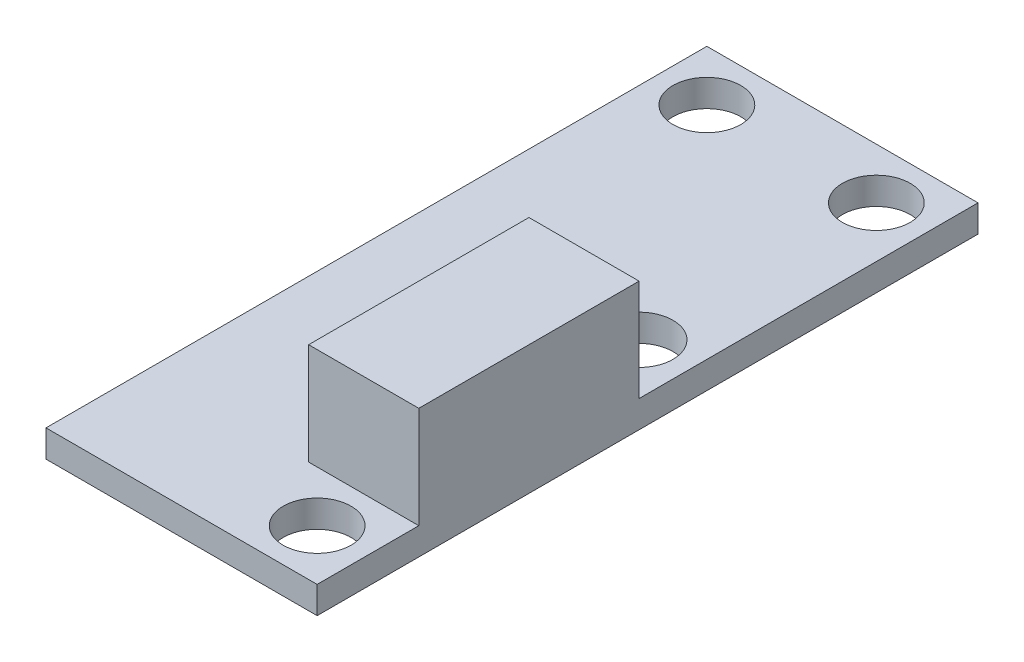
from build123d import *

# Parameters (mm, degrees)
SKETCH1_W           = 16
SKETCH1_H           = 39
SKETCH1_R           = 2
BOSS_EXTRUDE1_DEPTH = 0.8
SKETCH2_W           = 6.5
SKETCH2_H           = 13
BOSS_EXTRUDE2_DEPTH = 6


with BuildPart() as part:
    # Sketch1 → Boss-Extrude1 (new, symmetric)
    with BuildSketch(Plane(origin=(0, 0, 0), x_dir=(1, 0, 0), z_dir=(0, 1, 0))):
        Rectangle(SKETCH1_W, SKETCH1_H)
        with Locations(Location((5, -16.5, 0), (0, 0, 270))):
            Circle(SKETCH1_R, mode=Mode.SUBTRACT)
        with Locations(Location((5, 2.5, 0), (0, 0, 270))):
            Circle(SKETCH1_R, mode=Mode.SUBTRACT)
        with Locations(Location((5, 16.5, 0), (0, 0, 270))):
            Circle(SKETCH1_R, mode=Mode.SUBTRACT)
        with Locations(Location((-5, 16.5, 0), (0, 0, 270))):
            Circle(SKETCH1_R, mode=Mode.SUBTRACT)
    extrude(amount=BOSS_EXTRUDE1_DEPTH, both=True)

    # Sketch2 → Boss-Extrude2 (add)
    with BuildSketch(Plane(origin=(0, 0.8, 0), x_dir=(1, 0, 0), z_dir=(0, 1, 0))):
        with Locations((4.75, -7)):
            Rectangle(SKETCH2_W, SKETCH2_H)
    extrude(amount=BOSS_EXTRUDE2_DEPTH)


solid = part.part
